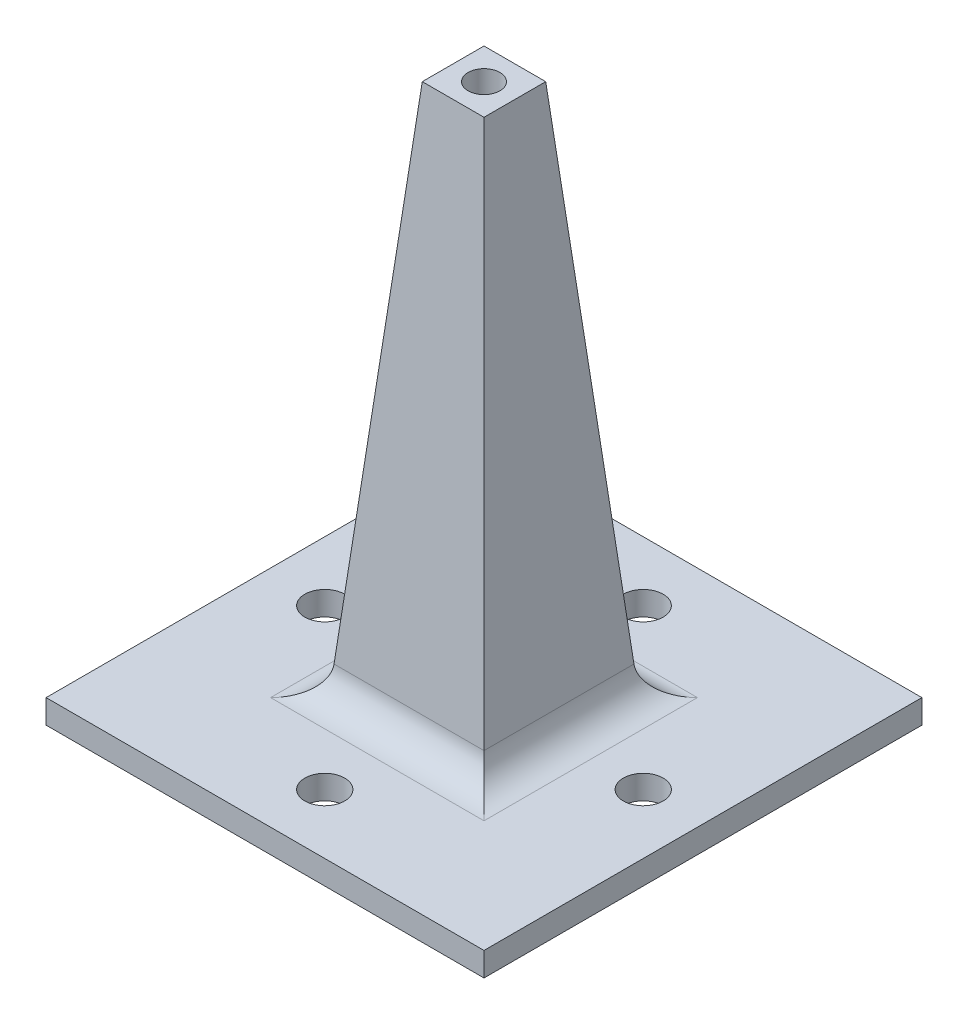
from build123d import *

# Parameters (mm, degrees)
SKETCH1_W           = 20
SKETCH1_H           = 20
BOSS_EXTRUDE1_DEPTH = 70
BOSS_EXTRUDE1_TAPER = 5
SKETCH2_R           = 2
CUT_EXTRUDE1_DEPTH  = 12.5
SKETCH3_W           = 55
SKETCH3_H           = 55
BOSS_EXTRUDE2_DEPTH = 3
FILLET1_R           = 4
SKETCH5_R           = 2.5
CUT_EXTRUDE2_DEPTH  = 10


with BuildPart() as part:
    # Sketch1 → Boss-Extrude1 (new body)
    with BuildSketch(Plane(origin=(0, 0, 0), x_dir=(1, 0, 0), z_dir=(0, 1, 0))):
        Rectangle(SKETCH1_W, SKETCH1_H)
    extrude(amount=BOSS_EXTRUDE1_DEPTH, taper=BOSS_EXTRUDE1_TAPER)

    # Sketch2 → Cut-Extrude1 (cut)
    with BuildSketch(Plane(origin=(0, 70, 0), x_dir=(1, 0, 0), z_dir=(0, 1, 0))):
        with Locations(Location((0, 0, 0), (0, 0, 270))):
            Circle(SKETCH2_R)
    extrude(amount=-CUT_EXTRUDE1_DEPTH, mode=Mode.SUBTRACT)

    # Sketch3 → Boss-Extrude2 (add)
    with BuildSketch(Plane.XZ):
        Rectangle(SKETCH3_W, SKETCH3_H)
    extrude(amount=-BOSS_EXTRUDE2_DEPTH)

    # Fillet1
    fillet1_edges = [part.edges().sort_by_distance(p)[0] for p in [
        (0, 3, 9.737534009),
        (0, 3, -9.737534009),
        (9.737534009, 3, 0),
        (-9.737534009, 3, 0),
    ]]
    fillet(fillet1_edges, radius=FILLET1_R)

    # Sketch5 → Cut-Extrude2 (cut)
    with BuildSketch(Plane(origin=(0, 3, 0), x_dir=(1, 0, 0), z_dir=(0, 1, 0))):
        with Locations(Location((-20, 0, 0), (0, 0, 270))):
            Circle(SKETCH5_R)
        with Locations(Location((0, 20, 0), (0, 0, 270))):
            Circle(SKETCH5_R)
        with Locations(Location((20, 0, 0), (0, 0, 270))):
            Circle(SKETCH5_R)
        with Locations(Location((0, -20, 0), (0, 0, 270))):
            Circle(SKETCH5_R)
    extrude(amount=-CUT_EXTRUDE2_DEPTH, mode=Mode.SUBTRACT)


solid = part.part
